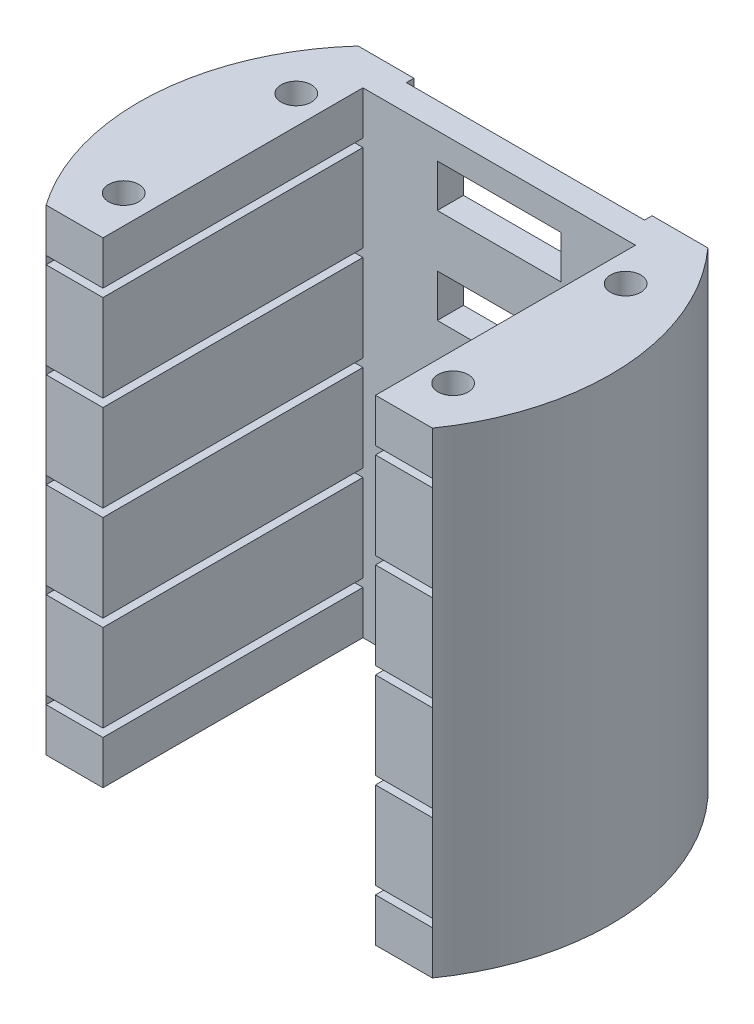
from build123d import *

# Parameters (mm, degrees)
BOSS_EXTRUDE2_DEPTH = 100
SKETCH2_W           = 26
SKETCH2_H           = 9
CUT_EXTRUDE1_DEPTH  = 10
SKETCH3_W           = 81.1
SKETCH3_H           = 1.7
CUT_EXTRUDE2_DEPTH  = 54.585490237
LPATTERN1_COUNT     = 5
LPATTERN1_PITCH     = 20
CUT_EXTRUDE3_START  = -100
SKETCH5_R           = 3.175
CUT_EXTRUDE3_DEPTH  = 100


with BuildPart() as part:
    # Sketch1 → Boss-Extrude2 (new body)
    with BuildSketch(Plane(origin=(0, 0, 0), x_dir=(1, 0, 0), z_dir=(0, 1, 0))):
        with BuildLine():
            Line((-40.55, -28.441490819), (-28.616848255, -28.441490819))
            Line((-28.616848255, -28.441490819), (-28.616848255, 26.143999418))
            Line((-28.616848255, 26.143999418), (28.616848255, 26.143999418))
            Line((28.616848255, 26.143999418), (28.616848255, -28.441490819))
            Line((28.616848255, -28.441490819), (40.55, -28.441490819))
            ThreePointArc((40.55, -28.441490819), (49.434601237, 3.072637396), (36.715901224, 33.243999418))
            Line((36.715901224, 33.243999418), (25, 33.243999418))
            Line((25, 33.243999418), (25, 31.643999418))
            Line((25, 31.643999418), (-25, 31.643999418))
            Line((-25, 31.643999418), (-25, 33.243999418))
            Line((-25, 33.243999418), (-36.715901224, 33.243999418))
            ThreePointArc((-36.715901224, 33.243999418), (-49.434601237, 3.072637396), (-40.55, -28.441490819))
        make_face()
    extrude(amount=BOSS_EXTRUDE2_DEPTH)

    # Sketch2 → Cut-Extrude1 (cut)
    with BuildSketch(Plane.XY.offset(-26.143999418)):
        with Locations((0, 10)):
            Rectangle(SKETCH2_W, SKETCH2_H)
    cut_extrude1 = extrude(amount=-CUT_EXTRUDE1_DEPTH, mode=Mode.SUBTRACT)

    # Sketch3 → Cut-Extrude2 (cut)
    with BuildSketch(Plane.XY.offset(28.441490819)):
        with Locations((0, 10)):
            Rectangle(SKETCH3_W, SKETCH3_H)
    cut_extrude2 = extrude(amount=-CUT_EXTRUDE2_DEPTH, mode=Mode.SUBTRACT)

    # LPattern1: Cut-Extrude1, Cut-Extrude2 ×5
    with Locations(*[(0, i * LPATTERN1_PITCH, 0) for i in range(1, LPATTERN1_COUNT)]):
        add(cut_extrude1, mode=Mode.SUBTRACT)
        add(cut_extrude2, mode=Mode.SUBTRACT)

    # Sketch5 → Cut-Extrude3 (cut)
    with BuildSketch(Plane(origin=(0, 100, 0), x_dir=(1, 0, 0), z_dir=(0, 1, 0)).offset(CUT_EXTRUDE3_START)):
        with Locations(Location((-34.583424127, -18.113346959, 0), (0, 0, 90))):
            Circle(SKETCH5_R)
        with Locations(Location((-34.583424127, 18.113346959, 0), (0, 0, 90))):
            Circle(SKETCH5_R)
        with Locations(Location((34.583424127, 18.113346959, 0), (0, 0, 90))):
            Circle(SKETCH5_R)
        with Locations(Location((34.583424127, -18.113346959, 0), (0, 0, 90))):
            Circle(SKETCH5_R)
    extrude(amount=CUT_EXTRUDE3_DEPTH, mode=Mode.SUBTRACT)


solid = part.part
